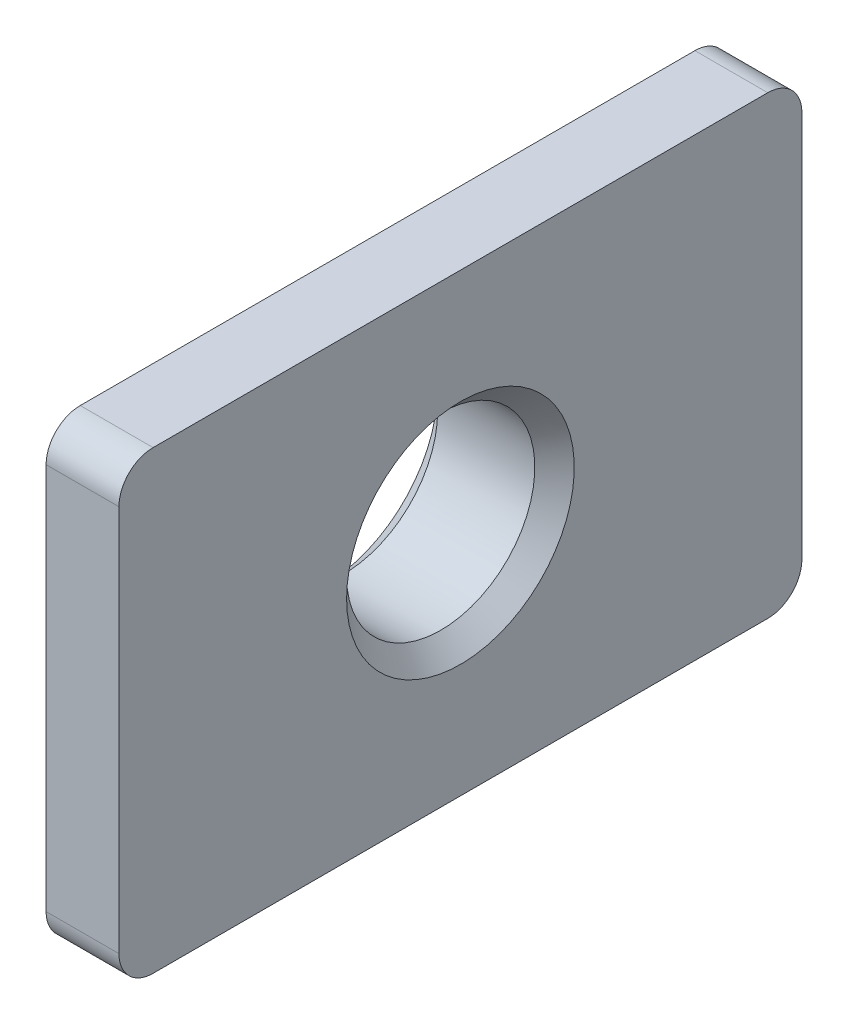
from build123d import *

# Parameters (mm, degrees)
BOSS_EXTRUDE1_DEPTH    = 1.6
SKETCH2_R              = 3.45
BOSS_EXTRUDE2_DEPTH    = 1.4
M3_5_CLEARANCE_HOLE1_D = 4.134
CHAMFER1_SIZE          = 0.433
CHAMFER2_SIZE          = 0.433


with BuildPart() as part:
    # Sketch1 → Boss-Extrude1 (new body)
    with BuildSketch(Plane(origin=(-1.6, 0, 0), x_dir=(0, -1, 0), z_dir=(-1, 0, 0))):
        with BuildLine():
            Line((4.25, 7.5), (-4.25, 7.5))
            ThreePointArc((-4.25, 7.5), (-4.780330086, 7.280330086), (-5, 6.75))
            Line((-5, 6.75), (-5, -6.75))
            ThreePointArc((-5, -6.75), (-4.780330086, -7.280330086), (-4.25, -7.5))
            Line((-4.25, -7.5), (4.25, -7.5))
            ThreePointArc((4.25, -7.5), (4.780330086, -7.280330086), (5, -6.75))
            Line((5, -6.75), (5, 6.75))
            ThreePointArc((5, 6.75), (4.780330086, 7.280330086), (4.25, 7.5))
        make_face()
    extrude(amount=-BOSS_EXTRUDE1_DEPTH)

    # Sketch2 → Boss-Extrude2 (add)
    with BuildSketch(Plane(origin=(-3, 0, 0), x_dir=(0, -1, 0), z_dir=(-1, 0, 0))):
        with Locations(Location((0, 0, 0), (0, 0, 90))):
            Circle(SKETCH2_R)
    extrude(amount=-BOSS_EXTRUDE2_DEPTH)

    # M3.5 Clearance Hole1 (through all)
    with Locations(Plane.ZY.offset(3)):
        with Locations((0, 0)):
            Hole(M3_5_CLEARANCE_HOLE1_D / 2)

    # Chamfer1
    chamfer1_edges = [part.edges().sort_by_distance(p)[0] for p in [
        (-3, 0, 2.067),
    ]]
    chamfer(chamfer1_edges, length=CHAMFER1_SIZE)

    # Chamfer2
    chamfer2_edges = [part.edges().sort_by_distance(p)[0] for p in [
        (0, 0, 2.067),
    ]]
    chamfer(chamfer2_edges, length=CHAMFER2_SIZE)


solid = part.part
